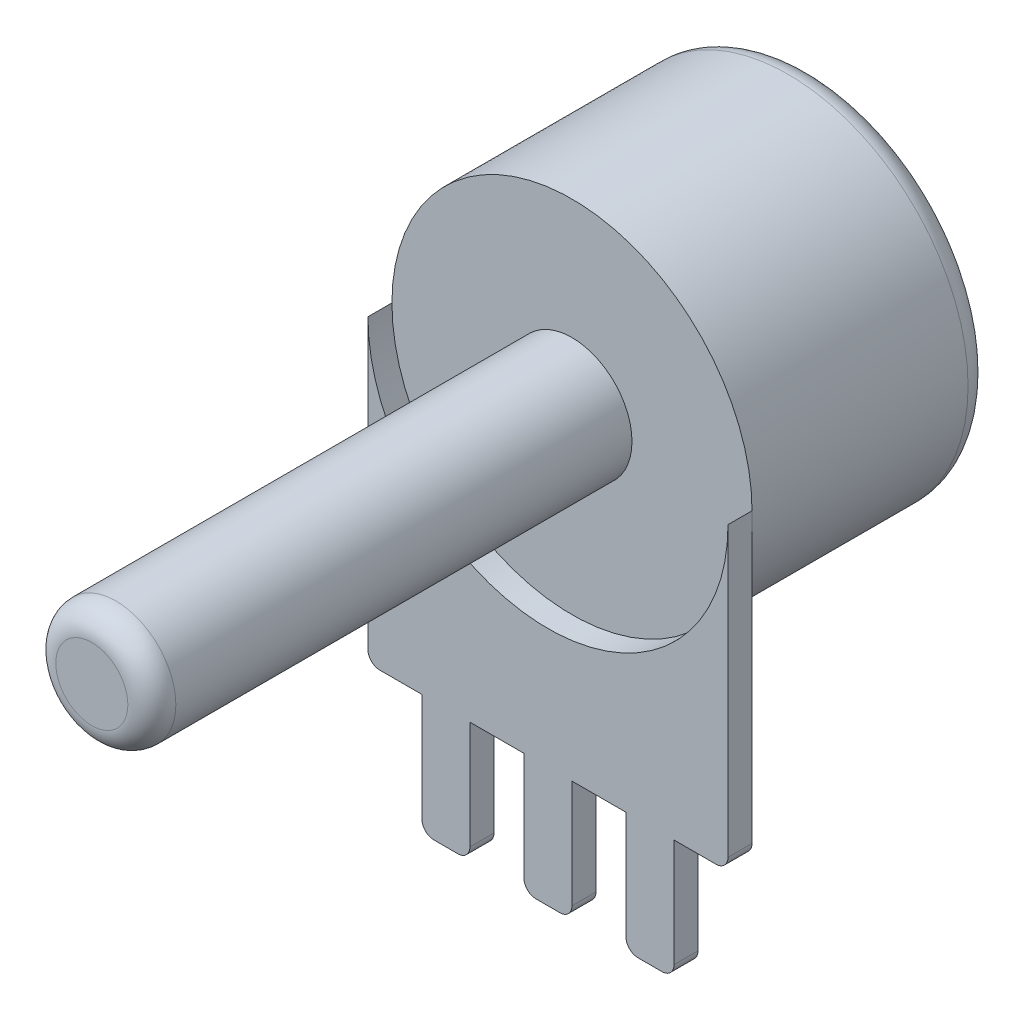
from build123d import *

# Parameters (mm, degrees)
IZIM1_R                     = 7.5
Y_KSEKLIK_EKSTR_ZYON1_DEPTH = 10
IZIM2_R                     = 2.5
Y_KSEKLIK_EKSTR_ZYON2_DEPTH = 20
Y_KSEKLIK_EKSTR_ZYON3_DEPTH = 1
RADYUS2_R                   = 1
RADYUS3_R                   = 1
RADYUS4_R                   = 0.5


with BuildPart() as part:
    # Çizim1 → Yükseklik-Ekstrüzyon1 (new body)
    with BuildSketch(Plane.XY):
        Circle(IZIM1_R)
    extrude(amount=Y_KSEKLIK_EKSTR_ZYON1_DEPTH)

    # Çizim2 → Yükseklik-Ekstrüzyon2 (add)
    with BuildSketch(Plane.XY.offset(10)):
        Circle(IZIM2_R)
    extrude(amount=Y_KSEKLIK_EKSTR_ZYON2_DEPTH)

    # Radyus2
    radyus2_edges = [part.edges().sort_by_distance(p)[0] for p in [
        (-7.5, 0, 0),
    ]]
    fillet(radyus2_edges, radius=RADYUS2_R)

    # Radyus3
    radyus3_edges = [part.edges().sort_by_distance(p)[0] for p in [
        (-2.5, 0, 30),
    ]]
    fillet(radyus3_edges, radius=RADYUS3_R)


with BuildPart() as body_2:
    # Çizim3 → Yükseklik-Ekstrüzyon3 (new body)
    with BuildSketch(Plane.XY.offset(10)):
        with BuildLine():
            Line((-7.5, 0), (-7.5, -7.5))
            Line((-7.5, -7.5), (-7.5, -12.5))
            Line((-7.5, -12.5), (-5.25, -12.5))
            Line((-5.25, -12.5), (-5.25, -17.5))
            Line((-5.25, -17.5), (-3.25, -17.5))
            Line((-3.25, -17.5), (-3.25, -12.5))
            Line((-3.25, -12.5), (-1, -12.5))
            Line((-1, -12.5), (-1, -17.5))
            Line((-1, -17.5), (1, -17.5))
            Line((1, -17.5), (1, -12.5))
            Line((1, -12.5), (3.25, -12.5))
            Line((3.25, -12.5), (3.25, -17.5))
            Line((3.25, -17.5), (5.25, -17.5))
            Line((5.25, -17.5), (5.25, -12.5))
            Line((5.25, -12.5), (7.5, -12.5))
            Line((7.5, -12.5), (7.5, -7.5))
            Line((7.5, -7.5), (7.5, 0))
            ThreePointArc((7.5, 0), (0, -7.5), (-7.5, 0))
        make_face()
    extrude(amount=Y_KSEKLIK_EKSTR_ZYON3_DEPTH)

    # Radyus4
    radyus4_edges = [body_2.edges().sort_by_distance(p)[0] for p in [
        (7.5, -12.5, 10.5),
        (5.25, -17.5, 10.5),
        (3.25, -17.5, 10.5),
        (1, -17.5, 10.5),
        (-1, -17.5, 10.5),
        (-3.25, -17.5, 10.5),
        (-5.25, -17.5, 10.5),
        (-7.5, -12.5, 10.5),
    ]]
    fillet(radyus4_edges, radius=RADYUS4_R)


solid = Compound([part.part, body_2.part])
